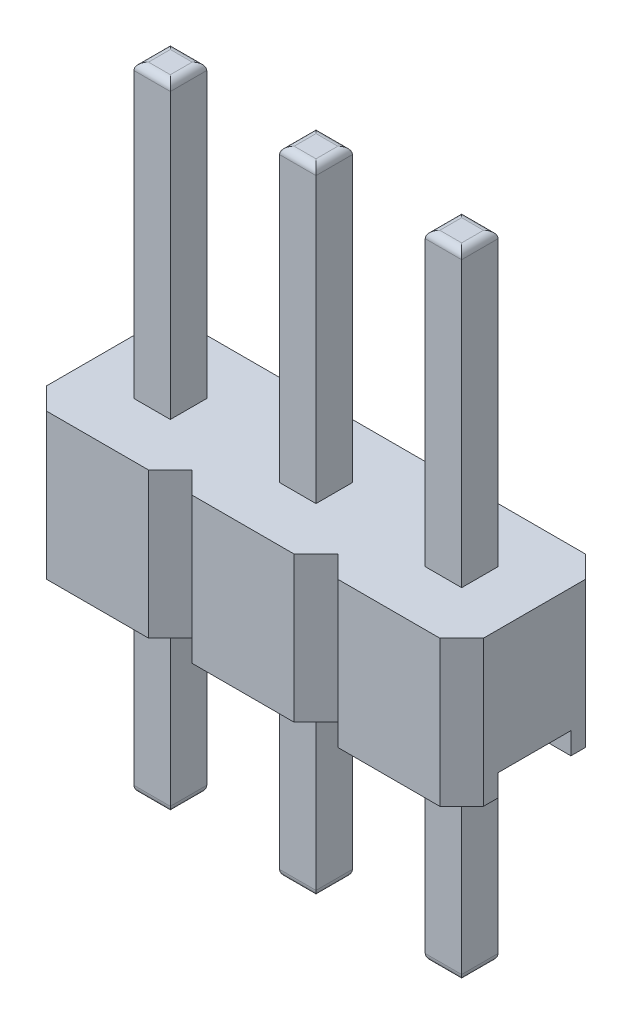
from build123d import *

# Parameters (mm, degrees)
SZKIC1_W                         = 6
SZKIC1_H                         = 2
DODANIE_WYCI_GNI_CIE1_DEPTH      = 2
SZKIC2_W                         = 8
SZKIC2_H                         = 4
WYTNIJ_WYCI_GNI_CIE1_DEPTH       = 2
WYTNIJ_WYCI_GNI_CIE2_REACH       = 8.403
SZKIC4_W                         = 1
SZKIC4_H                         = 0.3
DODANIE_WYCI_GNI_CIE2_DEPTH      = 6
DODANIE_WYCI_GNI_CIE2_DEPTH_BACK = 2.7
SZKIC3_W                         = 0.5
SZKIC3_H                         = 0.5
ZAOKR_GLENIE1_R                  = 0.1


with BuildPart() as part:
    # Szkic1 → Dodanie-wyciągnięcie1 (new body)
    with BuildSketch(Plane(origin=(0, 0, 0), x_dir=(1, 0, 0), z_dir=(0, 1, 0))):
        Rectangle(SZKIC1_W, SZKIC1_H)
    extrude(amount=DODANIE_WYCI_GNI_CIE1_DEPTH)

    # Szkic2 → Wytnij-wyciągnięcie1 (cut)
    with BuildSketch(Plane(origin=(0, 2, 0), x_dir=(1, 0, 0), z_dir=(0, 1, 0))):
        Rectangle(SZKIC2_W, SZKIC2_H)
        Polygon((2.7, 1), (3, 0.7), (3, -0.7), (2.7, -1), (1.3, -1), (1, -0.7), (0.7, -1), (-0.7, -1), (-1, -0.7), (-1.3, -1), (-2.7, -1), (-3, -0.7), (-3, 0.7), (-2.7, 1), (-1.3, 1), (-1, 0.7), (-0.7, 1), (0.7, 1), (1, 0.7), (1.3, 1), align=None, mode=Mode.SUBTRACT)
    extrude(amount=-WYTNIJ_WYCI_GNI_CIE1_DEPTH, mode=Mode.SUBTRACT)

    # Szkic4 → Wytnij-wyciągnięcie2 (cut, up to next)
    with BuildSketch(Plane.ZY.offset(3), mode=Mode.PRIVATE) as wytnij_wyci_gni_cie2_sk1:
        with Locations((0, 0.15)):
            Rectangle(SZKIC4_W, SZKIC4_H)
    wytnij_wyci_gni_cie2_tool1 = extrude(wytnij_wyci_gni_cie2_sk1.sketch, amount=-WYTNIJ_WYCI_GNI_CIE2_REACH, mode=Mode.PRIVATE) & part.part
    add(wytnij_wyci_gni_cie2_tool1.solids().sort_by_distance((-3, 0.15, 0))[0], mode=Mode.SUBTRACT)

    # Szkic3 → Dodanie-wyciągnięcie2 (add, two sides: drawn at the far end of the back side and taken through both)
    with BuildSketch(Plane(origin=(0, 0, 0), x_dir=(1, 0, 0), z_dir=(0, 1, 0)).offset(-DODANIE_WYCI_GNI_CIE2_DEPTH_BACK)):
        Rectangle(SZKIC3_W, SZKIC3_H)
        with Locations((2, 0)):
            Rectangle(SZKIC3_W, SZKIC3_H)
        with Locations((-2, 0)):
            Rectangle(SZKIC3_W, SZKIC3_H)
    extrude(amount=DODANIE_WYCI_GNI_CIE2_DEPTH + DODANIE_WYCI_GNI_CIE2_DEPTH_BACK)

    # Zaokrąglenie1
    zaokr_glenie1_edges = [part.edges().sort_by_distance(p)[0] for p in [
        (-0.25, -2.7, 0),
        (0, -2.7, -0.25),
        (0.25, -2.7, 0),
        (0, -2.7, 0.25),
        (-0.25, 6, 0),
        (0, 6, 0.25),
        (0.25, 6, 0),
        (0, 6, -0.25),
        (1.75, -2.7, 0),
        (2, -2.7, -0.25),
        (2.25, -2.7, 0),
        (2, -2.7, 0.25),
        (1.75, 6, 0),
        (2, 6, 0.25),
        (2.25, 6, 0),
        (2, 6, -0.25),
        (-2.25, -2.7, 0),
        (-2, -2.7, -0.25),
        (-1.75, -2.7, 0),
        (-2, -2.7, 0.25),
        (-2.25, 6, 0),
        (-2, 6, 0.25),
        (-1.75, 6, 0),
        (-2, 6, -0.25),
    ]]
    fillet(zaokr_glenie1_edges, radius=ZAOKR_GLENIE1_R)


solid = part.part
